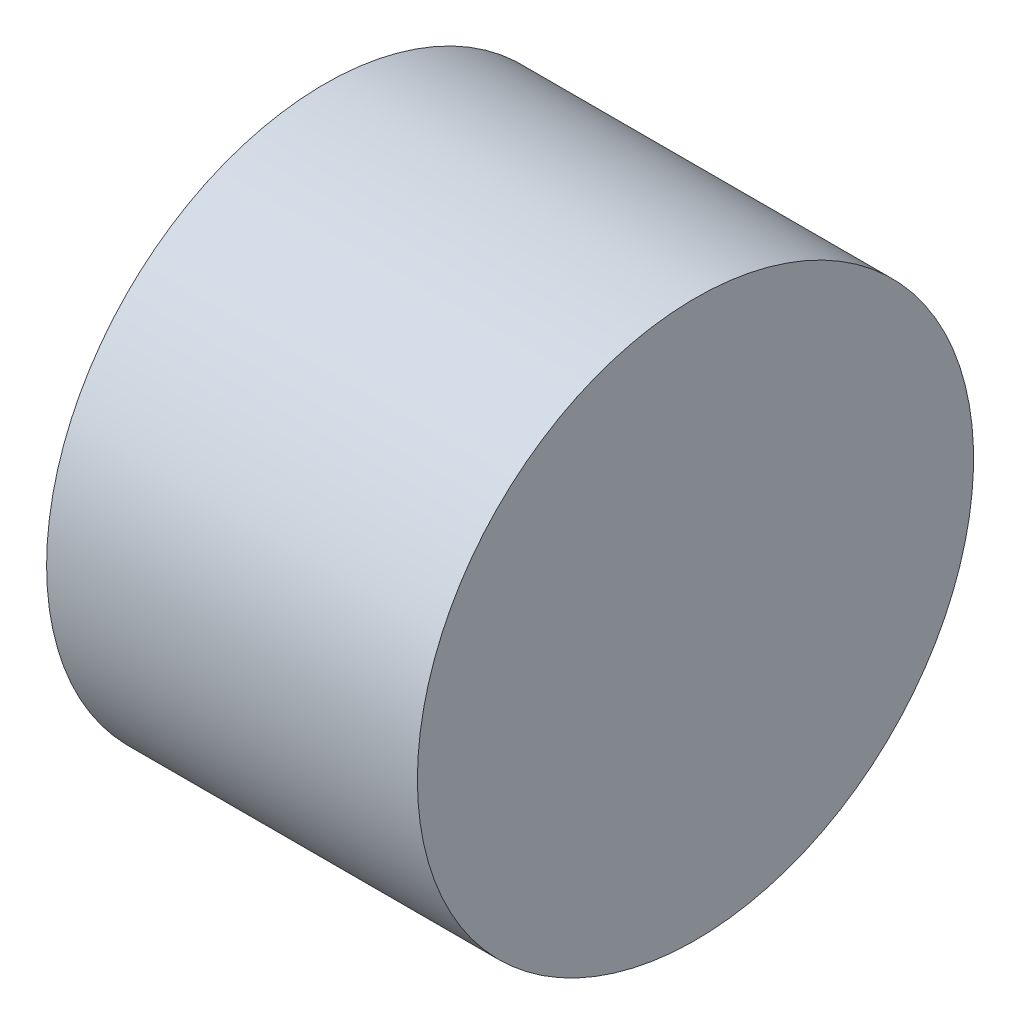
from build123d import *

# Parameters (mm, degrees)
SKETCH_1_W = 8
SKETCH_1_H = 6


with BuildPart() as part:
    # Эскиз1 → Повернуть1 (revolve)
    with BuildSketch(Plane.XY, mode=Mode.PRIVATE) as revolve_1_sk:
        with Locations((4, 3)):
            Rectangle(SKETCH_1_W, SKETCH_1_H)
    revolve(revolve_1_sk.sketch.rotate(Axis((0, 0, 0), (1, 0, 0)), 90), axis=Axis((0, 0, 0), (1, 0, 0)))


solid = part.part
